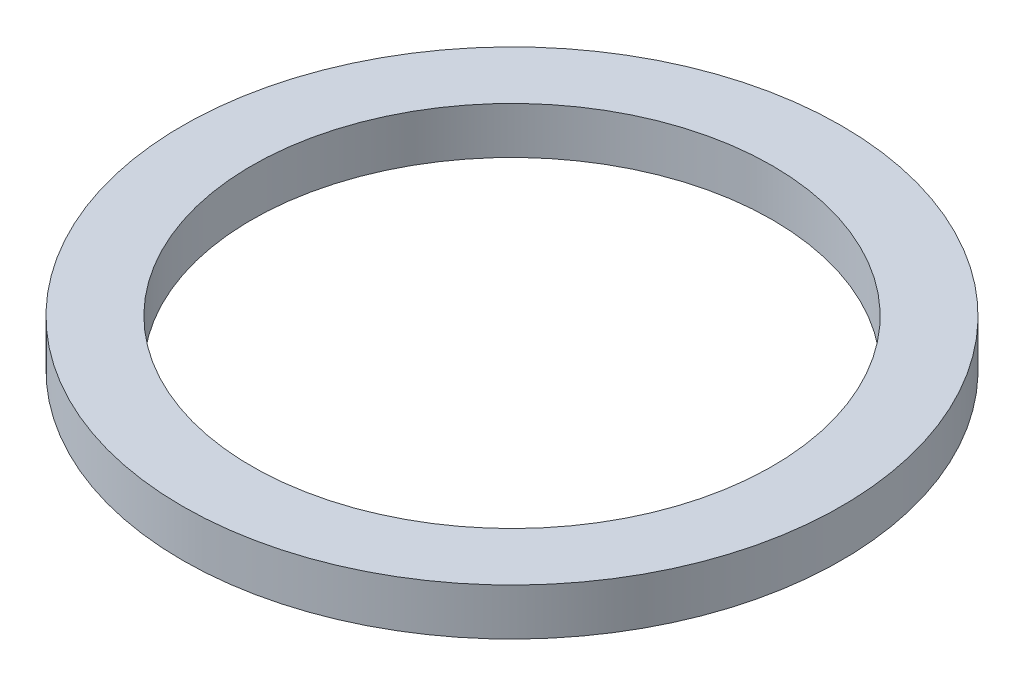
from build123d import *

# Parameters (mm, degrees)
SKETCH1_W = 1.775
SKETCH1_H = 1.2


with BuildPart() as part:
    # Sketch1 → Revolve1 (revolve)
    with BuildSketch(Plane(origin=(0, 0, 0), x_dir=(0, 0, -1), z_dir=(1, 0, 0))):
        with Locations((7.5625, 0.6)):
            Rectangle(SKETCH1_W, SKETCH1_H)
    revolve(axis=Axis((0, 0, 0), (0, 1, 0)))


solid = part.part
